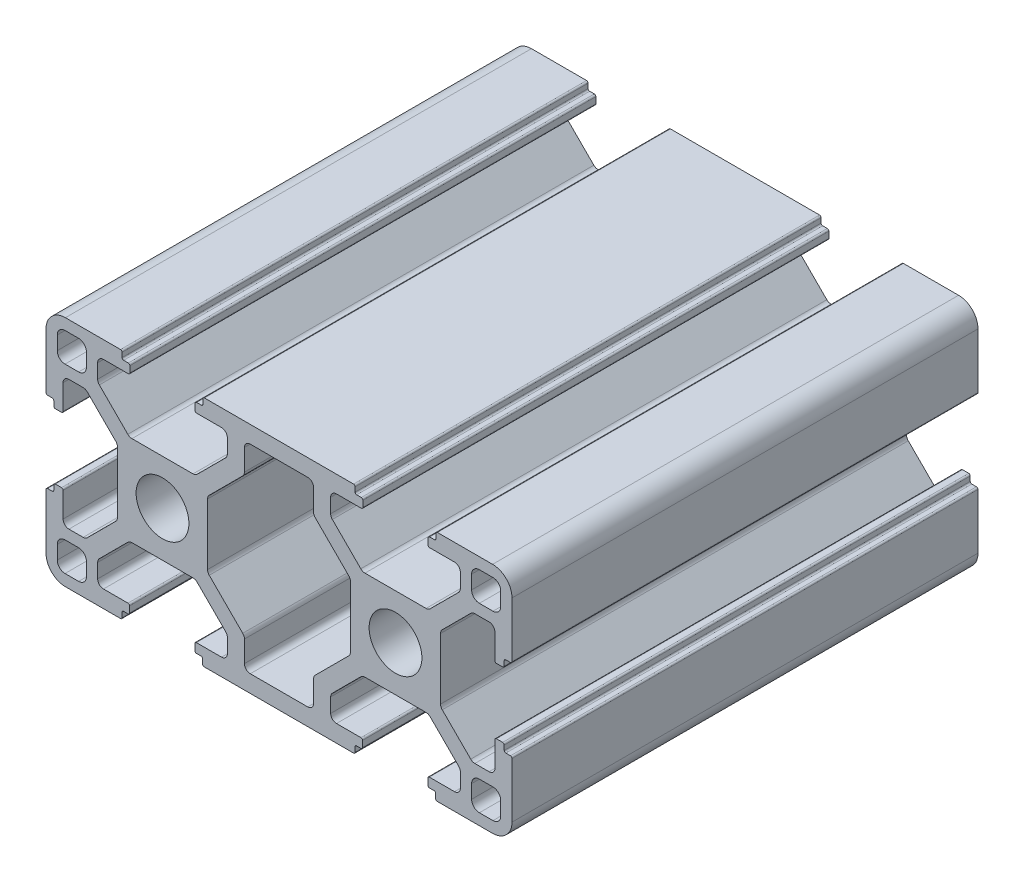
from build123d import *

# Parameters (mm, degrees)
SKETCH1_R           = 3.4
BOSS_EXTRUDE1_DEPTH = 60


with BuildPart() as part:
    # Sketch1 → Boss-Extrude1 (new body)
    with BuildSketch(Plane.XY):
        with BuildLine():
            Line((2.5, 0), (9.6, 0))
            ThreePointArc((9.6, 0), (9.741421356, 0.058578644), (9.8, 0.2))
            Line((9.8, 0.2), (9.8, 0.8))
            ThreePointArc((9.8, 0.8), (9.858578644, 0.941421356), (10, 1))
            Line((10, 1), (10.555634919, 1))
            ThreePointArc((10.555634919, 1), (10.697056275, 1.058578644), (10.755634919, 1.2))
            Line((10.755634919, 1.2), (10.755634919, 2))
            ThreePointArc((10.755634919, 2), (10.697056275, 2.141421356), (10.555634919, 2.2))
            Line((10.555634919, 2.2), (7.4, 2.2))
            ThreePointArc((7.4, 2.2), (6.869669914, 2.419669914), (6.65, 2.95))
            Line((6.65, 2.95), (6.65, 4.78370491))
            ThreePointArc((6.65, 4.78370491), (6.707090351, 5.070717484), (6.869669914, 5.314034996))
            Line((6.869669914, 5.314034996), (10.535965004, 8.980330086))
            ThreePointArc((10.535965004, 8.980330086), (10.779282516, 9.142909649), (11.06629509, 9.2))
            Line((11.06629509, 9.2), (18.93370491, 9.2))
            ThreePointArc((18.93370491, 9.2), (19.220717484, 9.142909649), (19.464034995, 8.980330086))
            Line((19.464034995, 8.980330086), (23.130330086, 5.314034996))
            ThreePointArc((23.130330086, 5.314034996), (23.292909649, 5.070717484), (23.35, 4.78370491))
            Line((23.35, 4.78370491), (23.35, 2.95))
            ThreePointArc((23.35, 2.95), (23.130330086, 2.419669914), (22.6, 2.2))
            Line((22.6, 2.2), (19.355634919, 2.2))
            ThreePointArc((19.355634919, 2.2), (19.214213562, 2.141421356), (19.155634919, 2))
            Line((19.155634919, 2), (19.155634919, 1.2))
            ThreePointArc((19.155634919, 1.2), (19.214213562, 1.058578644), (19.355634919, 1))
            Line((19.355634919, 1), (19.955634919, 1))
            ThreePointArc((19.955634919, 1), (20.097056275, 0.941421356), (20.155634919, 0.8))
            Line((20.155634919, 0.8), (20.155634919, 0.2))
            ThreePointArc((20.155634919, 0.2), (20.214213562, 0.058578644), (20.355634919, 0))
            Line((20.355634919, 0), (39.6, 0))
            ThreePointArc((39.6, 0), (39.741421356, 0.058578644), (39.8, 0.2))
            Line((39.8, 0.2), (39.8, 0.8))
            ThreePointArc((39.8, 0.8), (39.858578644, 0.941421356), (40, 1))
            Line((40, 1), (40.555634919, 1))
            ThreePointArc((40.555634919, 1), (40.697056275, 1.058578644), (40.755634919, 1.2))
            Line((40.755634919, 1.2), (40.755634919, 2))
            ThreePointArc((40.755634919, 2), (40.697056275, 2.141421356), (40.555634919, 2.2))
            Line((40.555634919, 2.2), (37.4, 2.2))
            ThreePointArc((37.4, 2.2), (36.869669914, 2.419669914), (36.65, 2.95))
            Line((36.65, 2.95), (36.65, 4.78370491))
            ThreePointArc((36.65, 4.78370491), (36.707090351, 5.070717484), (36.869669914, 5.314034995))
            Line((36.869669914, 5.314034995), (40.535965005, 8.980330086))
            ThreePointArc((40.535965005, 8.980330086), (40.779282516, 9.142909649), (41.06629509, 9.2))
            Line((41.06629509, 9.2), (48.93370491, 9.2))
            ThreePointArc((48.93370491, 9.2), (49.220717484, 9.142909649), (49.464034995, 8.980330086))
            Line((49.464034995, 8.980330086), (53.130330086, 5.314034995))
            ThreePointArc((53.130330086, 5.314034995), (53.292909649, 5.070717484), (53.35, 4.78370491))
            Line((53.35, 4.78370491), (53.35, 2.95))
            ThreePointArc((53.35, 2.95), (53.130330086, 2.419669914), (52.6, 2.2))
            Line((52.6, 2.2), (49.355634919, 2.2))
            ThreePointArc((49.355634919, 2.2), (49.214213562, 2.141421356), (49.155634919, 2))
            Line((49.155634919, 2), (49.155634919, 1.2))
            ThreePointArc((49.155634919, 1.2), (49.214213562, 1.058578644), (49.355634919, 1))
            Line((49.355634919, 1), (49.955634919, 1))
            ThreePointArc((49.955634919, 1), (50.097056275, 0.941421356), (50.155634919, 0.8))
            Line((50.155634919, 0.8), (50.155634919, 0.2))
            ThreePointArc((50.155634919, 0.2), (50.214213562, 0.058578644), (50.355634919, 0))
            Line((50.355634919, 0), (57.5, 0))
            ThreePointArc((57.5, 0), (59.267766953, 0.732233047), (60, 2.5))
            Line((60, 2.5), (60, 9.6))
            ThreePointArc((60, 9.6), (59.941421356, 9.741421356), (59.8, 9.8))
            Line((59.8, 9.8), (59.2, 9.8))
            ThreePointArc((59.2, 9.8), (59.058578644, 9.858578644), (59, 10))
            Line((59, 10), (59, 10.6))
            ThreePointArc((59, 10.6), (58.941421356, 10.741421356), (58.8, 10.8))
            Line((58.8, 10.8), (58, 10.8))
            ThreePointArc((58, 10.8), (57.858578644, 10.741421356), (57.8, 10.6))
            Line((57.8, 10.6), (57.8, 7.4))
            ThreePointArc((57.8, 7.4), (57.580330086, 6.869669914), (57.05, 6.65))
            Line((57.05, 6.65), (55.21629509, 6.65))
            ThreePointArc((55.21629509, 6.65), (54.929282516, 6.707090351), (54.685965005, 6.869669914))
            Line((54.685965005, 6.869669914), (51.019669914, 10.535965004))
            ThreePointArc((51.019669914, 10.535965004), (50.857090351, 10.779282516), (50.8, 11.06629509))
            Line((50.8, 11.06629509), (50.8, 18.93370491))
            ThreePointArc((50.8, 18.93370491), (50.857090351, 19.220717484), (51.019669914, 19.464034996))
            Line((51.019669914, 19.464034996), (54.685965004, 23.130330086))
            ThreePointArc((54.685965004, 23.130330086), (54.929282516, 23.292909649), (55.21629509, 23.35))
            Line((55.21629509, 23.35), (57.05, 23.35))
            ThreePointArc((57.05, 23.35), (57.580330086, 23.130330086), (57.8, 22.6))
            Line((57.8, 22.6), (57.8, 19.4))
            ThreePointArc((57.8, 19.4), (57.858578644, 19.258578644), (58, 19.2))
            Line((58, 19.2), (58.8, 19.2))
            ThreePointArc((58.8, 19.2), (58.941421356, 19.258578644), (59, 19.4))
            Line((59, 19.4), (59, 20))
            ThreePointArc((59, 20), (59.058578644, 20.141421356), (59.2, 20.2))
            Line((59.2, 20.2), (59.8, 20.2))
            ThreePointArc((59.8, 20.2), (59.941421356, 20.258578644), (60, 20.4))
            Line((60, 20.4), (60, 27.5))
            ThreePointArc((60, 27.5), (59.267766953, 29.267766953), (57.5, 30))
            Line((57.5, 30), (50.4, 30))
            ThreePointArc((50.4, 30), (50.258578644, 29.941421356), (50.2, 29.8))
            Line((50.2, 29.8), (50.2, 29.2))
            ThreePointArc((50.2, 29.2), (50.141421356, 29.058578644), (50, 29))
            Line((50, 29), (49.4, 29))
            ThreePointArc((49.4, 29), (49.258578644, 28.941421356), (49.2, 28.8))
            Line((49.2, 28.8), (49.2, 28))
            ThreePointArc((49.2, 28), (49.258578644, 27.858578644), (49.4, 27.8))
            Line((49.4, 27.8), (52.6, 27.8))
            ThreePointArc((52.6, 27.8), (53.130330086, 27.580330086), (53.35, 27.05))
            Line((53.35, 27.05), (53.35, 25.21629509))
            ThreePointArc((53.35, 25.21629509), (53.292909649, 24.929282516), (53.130330086, 24.685965005))
            Line((53.130330086, 24.685965005), (49.464034995, 21.019669914))
            ThreePointArc((49.464034995, 21.019669914), (49.220717484, 20.857090351), (48.93370491, 20.8))
            Line((48.93370491, 20.8), (41.06629509, 20.8))
            ThreePointArc((41.06629509, 20.8), (40.779282516, 20.857090351), (40.535965005, 21.019669914))
            Line((40.535965005, 21.019669914), (36.869669914, 24.685965004))
            ThreePointArc((36.869669914, 24.685965004), (36.707090351, 24.929282516), (36.65, 25.21629509))
            Line((36.65, 25.21629509), (36.65, 27.05))
            ThreePointArc((36.65, 27.05), (36.869669914, 27.580330086), (37.4, 27.8))
            Line((37.4, 27.8), (40.6, 27.8))
            ThreePointArc((40.6, 27.8), (40.741421356, 27.858578644), (40.8, 28))
            Line((40.8, 28), (40.8, 28.8))
            ThreePointArc((40.8, 28.8), (40.741421356, 28.941421356), (40.6, 29))
            Line((40.6, 29), (40, 29))
            ThreePointArc((40, 29), (39.858578644, 29.058578644), (39.8, 29.2))
            Line((39.8, 29.2), (39.8, 29.8))
            ThreePointArc((39.8, 29.8), (39.741421356, 29.941421356), (39.6, 30))
            Line((39.6, 30), (20.4, 30))
            ThreePointArc((20.4, 30), (20.258578644, 29.941421356), (20.2, 29.8))
            Line((20.2, 29.8), (20.2, 29.2))
            ThreePointArc((20.2, 29.2), (20.141421356, 29.058578644), (20, 29))
            Line((20, 29), (19.4, 29))
            ThreePointArc((19.4, 29), (19.258578644, 28.941421356), (19.2, 28.8))
            Line((19.2, 28.8), (19.2, 28))
            ThreePointArc((19.2, 28), (19.258578644, 27.858578644), (19.4, 27.8))
            Line((19.4, 27.8), (22.6, 27.8))
            ThreePointArc((22.6, 27.8), (23.130330086, 27.580330086), (23.35, 27.05))
            Line((23.35, 27.05), (23.35, 25.21629509))
            ThreePointArc((23.35, 25.21629509), (23.292909649, 24.929282516), (23.130330086, 24.685965004))
            Line((23.130330086, 24.685965004), (19.464034995, 21.019669914))
            ThreePointArc((19.464034995, 21.019669914), (19.220717484, 20.857090351), (18.93370491, 20.8))
            Line((18.93370491, 20.8), (11.06629509, 20.8))
            ThreePointArc((11.06629509, 20.8), (10.779282516, 20.857090351), (10.535965004, 21.019669914))
            Line((10.535965004, 21.019669914), (6.869669914, 24.685965005))
            ThreePointArc((6.869669914, 24.685965005), (6.707090351, 24.929282516), (6.65, 25.21629509))
            Line((6.65, 25.21629509), (6.65, 27.05))
            ThreePointArc((6.65, 27.05), (6.869669914, 27.580330086), (7.4, 27.8))
            Line((7.4, 27.8), (10.6, 27.8))
            ThreePointArc((10.6, 27.8), (10.741421356, 27.858578644), (10.8, 28))
            Line((10.8, 28), (10.8, 28.8))
            ThreePointArc((10.8, 28.8), (10.741421356, 28.941421356), (10.6, 29))
            Line((10.6, 29), (10, 29))
            ThreePointArc((10, 29), (9.858578644, 29.058578644), (9.8, 29.2))
            Line((9.8, 29.2), (9.8, 29.8))
            ThreePointArc((9.8, 29.8), (9.741421356, 29.941421356), (9.6, 30))
            Line((9.6, 30), (2.5, 30))
            ThreePointArc((2.5, 30), (0.732233047, 29.267766953), (0, 27.5))
            Line((0, 27.5), (0, 20.4))
            ThreePointArc((0, 20.4), (0.058578644, 20.258578644), (0.2, 20.2))
            Line((0.2, 20.2), (0.8, 20.2))
            ThreePointArc((0.8, 20.2), (0.941421356, 20.141421356), (1, 20))
            Line((1, 20), (1, 19.4))
            ThreePointArc((1, 19.4), (1.058578644, 19.258578644), (1.2, 19.2))
            Line((1.2, 19.2), (2, 19.2))
            ThreePointArc((2, 19.2), (2.141421356, 19.258578644), (2.2, 19.4))
            Line((2.2, 19.4), (2.2, 22.6))
            ThreePointArc((2.2, 22.6), (2.419669914, 23.130330086), (2.95, 23.35))
            Line((2.95, 23.35), (4.78370491, 23.35))
            ThreePointArc((4.78370491, 23.35), (5.070717484, 23.292909649), (5.314034995, 23.130330086))
            Line((5.314034995, 23.130330086), (8.980330086, 19.464034995))
            ThreePointArc((8.980330086, 19.464034995), (9.142909649, 19.220717484), (9.2, 18.93370491))
            Line((9.2, 18.93370491), (9.2, 11.06629509))
            ThreePointArc((9.2, 11.06629509), (9.142909649, 10.779282516), (8.980330086, 10.535965005))
            Line((8.980330086, 10.535965005), (5.314034995, 6.869669914))
            ThreePointArc((5.314034995, 6.869669914), (5.070717484, 6.707090351), (4.78370491, 6.65))
            Line((4.78370491, 6.65), (2.95, 6.65))
            ThreePointArc((2.95, 6.65), (2.419669914, 6.869669914), (2.2, 7.4))
            Line((2.2, 7.4), (2.2, 10.6))
            ThreePointArc((2.2, 10.6), (2.141421356, 10.741421356), (2, 10.8))
            Line((2, 10.8), (1.2, 10.8))
            ThreePointArc((1.2, 10.8), (1.058578644, 10.741421356), (1, 10.6))
            Line((1, 10.6), (1, 10))
            ThreePointArc((1, 10), (0.941421356, 9.858578644), (0.8, 9.8))
            Line((0.8, 9.8), (0.2, 9.8))
            ThreePointArc((0.2, 9.8), (0.058578644, 9.741421356), (0, 9.6))
            Line((0, 9.6), (0, 2.5))
            ThreePointArc((0, 2.5), (0.732233047, 0.732233047), (2.5, 0))
        make_face()
        with Locations((15, 15)):
            Circle(SKETCH1_R, mode=Mode.SUBTRACT)
        with Locations((45, 15)):
            Circle(SKETCH1_R, mode=Mode.SUBTRACT)
        with BuildLine():
            Line((21.019669914, 10.535965005), (25.330330086, 6.225304833))
            ThreePointArc((25.330330086, 6.225304833), (25.492909649, 5.981987321), (25.55, 5.694974747))
            Line((25.55, 5.694974747), (25.55, 2.95))
            ThreePointArc((25.55, 2.95), (25.769669914, 2.419669914), (26.3, 2.2))
            Line((26.3, 2.2), (33.7, 2.2))
            ThreePointArc((33.7, 2.2), (34.230330086, 2.419669914), (34.45, 2.95))
            Line((34.45, 2.95), (34.45, 5.694974747))
            ThreePointArc((34.45, 5.694974747), (34.507090351, 5.981987321), (34.669669914, 6.225304833))
            Line((34.669669914, 6.225304833), (38.980330086, 10.535965005))
            ThreePointArc((38.980330086, 10.535965005), (39.142909649, 10.779282516), (39.2, 11.06629509))
            Line((39.2, 11.06629509), (39.2, 18.93370491))
            ThreePointArc((39.2, 18.93370491), (39.142909649, 19.220717484), (38.980330086, 19.464034995))
            Line((38.980330086, 19.464034995), (34.669669914, 23.774695167))
            ThreePointArc((34.669669914, 23.774695167), (34.507090351, 24.018012679), (34.45, 24.305025253))
            Line((34.45, 24.305025253), (34.45, 27.05))
            ThreePointArc((34.45, 27.05), (34.230330086, 27.580330086), (33.7, 27.8))
            Line((33.7, 27.8), (26.3, 27.8))
            ThreePointArc((26.3, 27.8), (25.769669914, 27.580330086), (25.55, 27.05))
            Line((25.55, 27.05), (25.55, 24.305025253))
            ThreePointArc((25.55, 24.305025253), (25.492909649, 24.018012679), (25.330330086, 23.774695167))
            Line((25.330330086, 23.774695167), (21.019669914, 19.464034996))
            ThreePointArc((21.019669914, 19.464034996), (20.857090351, 19.220717484), (20.8, 18.93370491))
            Line((20.8, 18.93370491), (20.8, 11.06629509))
            ThreePointArc((20.8, 11.06629509), (20.857090351, 10.779282516), (21.019669914, 10.535965005))
        make_face(mode=Mode.SUBTRACT)
        with BuildLine():
            Line((4.2, 24.8), (2.45, 24.8))
            ThreePointArc((2.45, 24.8), (1.742893219, 25.092893219), (1.45, 25.8))
            Line((1.45, 25.8), (1.45, 27.55))
            ThreePointArc((1.45, 27.55), (1.742893219, 28.257106781), (2.45, 28.55))
            Line((2.45, 28.55), (4.2, 28.55))
            ThreePointArc((4.2, 28.55), (4.907106781, 28.257106781), (5.2, 27.55))
            Line((5.2, 27.55), (5.2, 25.8))
            ThreePointArc((5.2, 25.8), (4.907106781, 25.092893219), (4.2, 24.8))
        make_face(mode=Mode.SUBTRACT)
        with BuildLine():
            Line((55.8, 28.55), (57.55, 28.55))
            ThreePointArc((57.55, 28.55), (58.257106781, 28.257106781), (58.55, 27.55))
            Line((58.55, 27.55), (58.55, 25.8))
            ThreePointArc((58.55, 25.8), (58.257106781, 25.092893219), (57.55, 24.8))
            Line((57.55, 24.8), (55.8, 24.8))
            ThreePointArc((55.8, 24.8), (55.092893219, 25.092893219), (54.8, 25.8))
            Line((54.8, 25.8), (54.8, 27.55))
            ThreePointArc((54.8, 27.55), (55.092893219, 28.257106781), (55.8, 28.55))
        make_face(mode=Mode.SUBTRACT)
        with BuildLine():
            Line((58.55, 4.2), (58.55, 2.45))
            ThreePointArc((58.55, 2.45), (58.257106781, 1.742893219), (57.55, 1.45))
            Line((57.55, 1.45), (55.8, 1.45))
            ThreePointArc((55.8, 1.45), (55.092893219, 1.742893219), (54.8, 2.45))
            Line((54.8, 2.45), (54.8, 4.2))
            ThreePointArc((54.8, 4.2), (55.092893219, 4.907106781), (55.8, 5.2))
            Line((55.8, 5.2), (57.55, 5.2))
            ThreePointArc((57.55, 5.2), (58.257106781, 4.907106781), (58.55, 4.2))
        make_face(mode=Mode.SUBTRACT)
        with BuildLine():
            Line((1.45, 4.2), (1.45, 2.45))
            ThreePointArc((1.45, 2.45), (1.742893219, 1.742893219), (2.45, 1.45))
            Line((2.45, 1.45), (4.2, 1.45))
            ThreePointArc((4.2, 1.45), (4.907106781, 1.742893219), (5.2, 2.45))
            Line((5.2, 2.45), (5.2, 4.2))
            ThreePointArc((5.2, 4.2), (4.907106781, 4.907106781), (4.2, 5.2))
            Line((4.2, 5.2), (2.45, 5.2))
            ThreePointArc((2.45, 5.2), (1.742893219, 4.907106781), (1.45, 4.2))
        make_face(mode=Mode.SUBTRACT)
    extrude(amount=BOSS_EXTRUDE1_DEPTH)


solid = part.part
